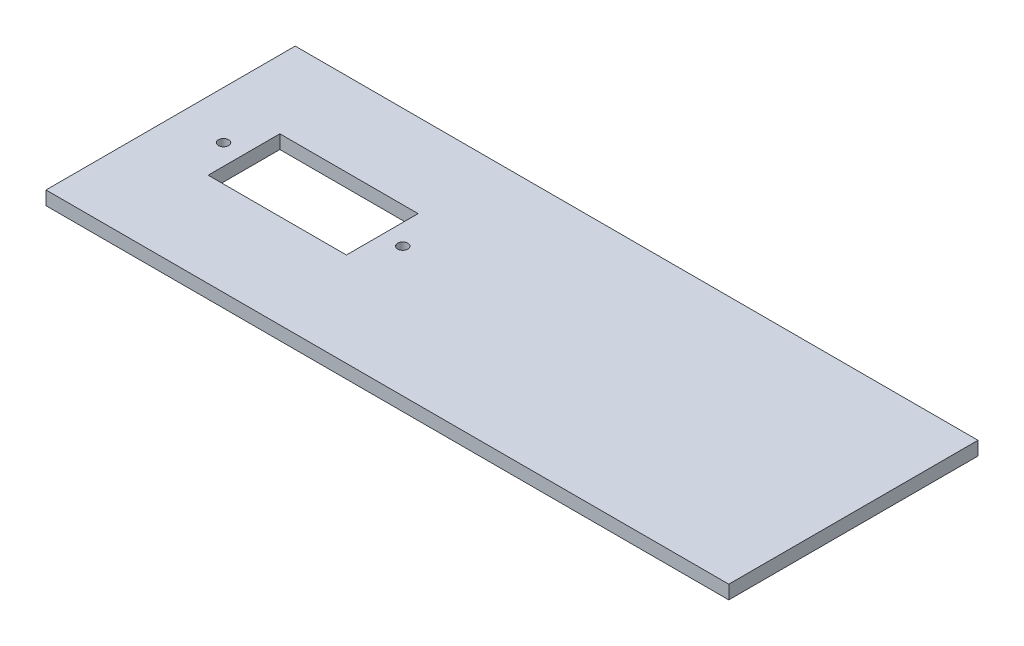
from build123d import *

# Parameters (mm, degrees)
SKETCH1_W           = 73
SKETCH1_H           = 4
BOSS_EXTRUDE1_DEPTH = 200
SKETCH2_R           = 1.5
SKETCH2_W           = 40.5
SKETCH2_H           = 21
CUT_EXTRUDE1_DEPTH  = 2000


with BuildPart() as part:
    # Sketch1 → Boss-Extrude1 (new body)
    with BuildSketch(Plane(origin=(0, 0, 0), x_dir=(0, 0, -1), z_dir=(1, 0, 0))):
        Rectangle(SKETCH1_W, SKETCH1_H)
    extrude(amount=-BOSS_EXTRUDE1_DEPTH)

    # Sketch2 → Cut-Extrude1 (cut)
    with BuildSketch(Plane(origin=(0, 2, 0), x_dir=(1, 0, 0), z_dir=(0, 1, 0))):
        with Locations(Location((-186, 1.5, 0), (0, 0, 270))):
            Circle(SKETCH2_R)
        with Locations(Location((-133.5, 1.5, 0), (0, 0, 90))):
            Circle(SKETCH2_R)
        with Locations((-159.75, 1.5)):
            Rectangle(SKETCH2_W, SKETCH2_H)
    extrude(amount=-CUT_EXTRUDE1_DEPTH, mode=Mode.SUBTRACT)


solid = part.part
